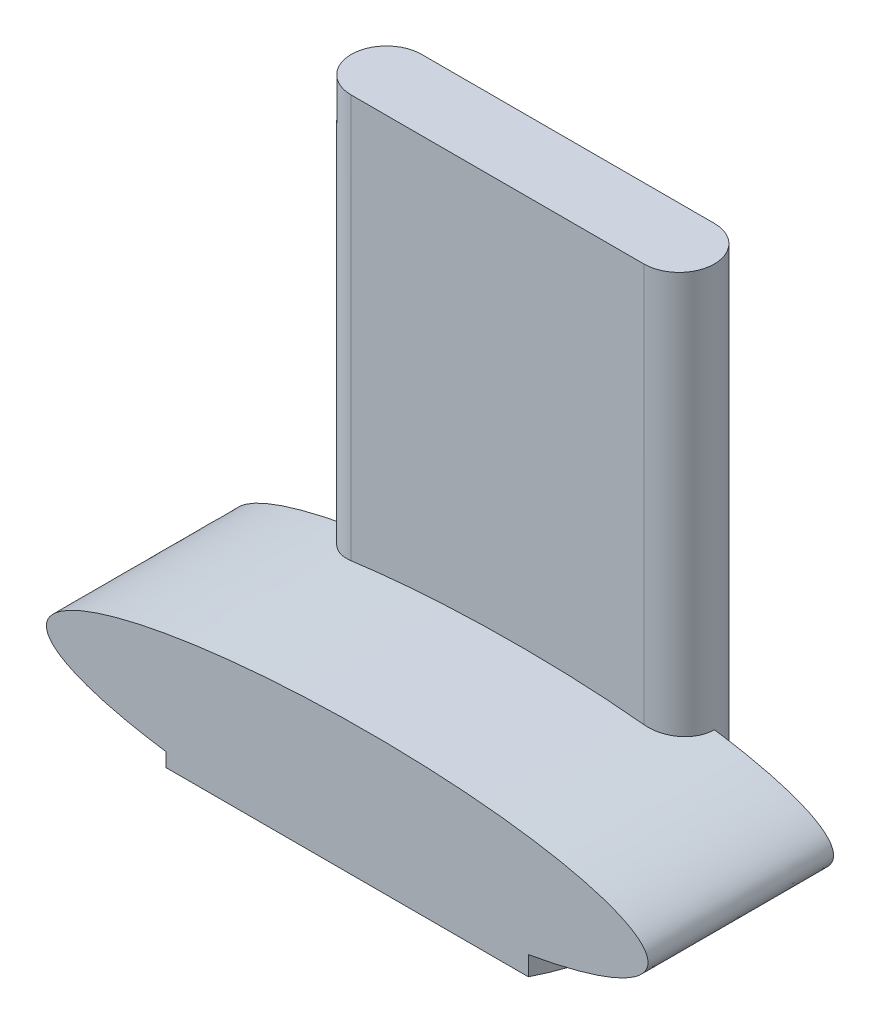
from build123d import *

# Parameters (mm, degrees)
SKETCH2_RX          = 47.005912867
SKETCH2_RY          = 10.001258057
BOSS_EXTRUDE2_DEPTH = 29
BOSS_EXTRUDE3_DEPTH = 4
BOSS_EXTRUDE4_DEPTH = 70


with BuildPart() as part:
    # Sketch2 → Boss-Extrude2 (new body)
    with BuildSketch(Plane.XY):
        with Locations(Location((-67.802373164, 6.5712636), (0, 0, 0.908793004))):
            Ellipse(SKETCH2_RX, SKETCH2_RY)
    extrude(amount=BOSS_EXTRUDE2_DEPTH)

    # Sketch3 → Boss-Extrude3 (add)
    with BuildSketch(Plane(origin=(0, 0, 0), x_dir=(1, 0, 0), z_dir=(0, 1, 0))):
        with BuildLine():
            Line((-96.108391235, -29), (-39.496355092, -29))
            ThreePointArc((-39.496355092, -29), (-35.998589441, -14.5), (-39.496355092, 0))
            Line((-39.496355092, 0), (-96.108391235, 0))
            ThreePointArc((-96.108391235, 0), (-99.606156886, -14.5), (-96.108391235, -29))
        make_face()
    extrude(amount=-BOSS_EXTRUDE3_DEPTH)

    # Sketch5 → Boss-Extrude4 (add)
    with BuildSketch(Plane(origin=(0, 7.999999876, 0), x_dir=(-1, 0, 0), z_dir=(0, -1, 0))):
        with BuildLine():
            Line((44.932105476, 5.499725114), (90.672640852, 5.499725114))
            ThreePointArc((90.672640852, 5.499725114), (96.172365966, 0), (90.672640852, -5.499725114))
            Line((90.672640852, -5.499725114), (44.932105476, -5.499725114))
            ThreePointArc((44.932105476, -5.499725114), (39.432380362, 0), (44.932105476, 5.499725114))
        make_face()
    extrude(amount=-BOSS_EXTRUDE4_DEPTH)


solid = part.part
